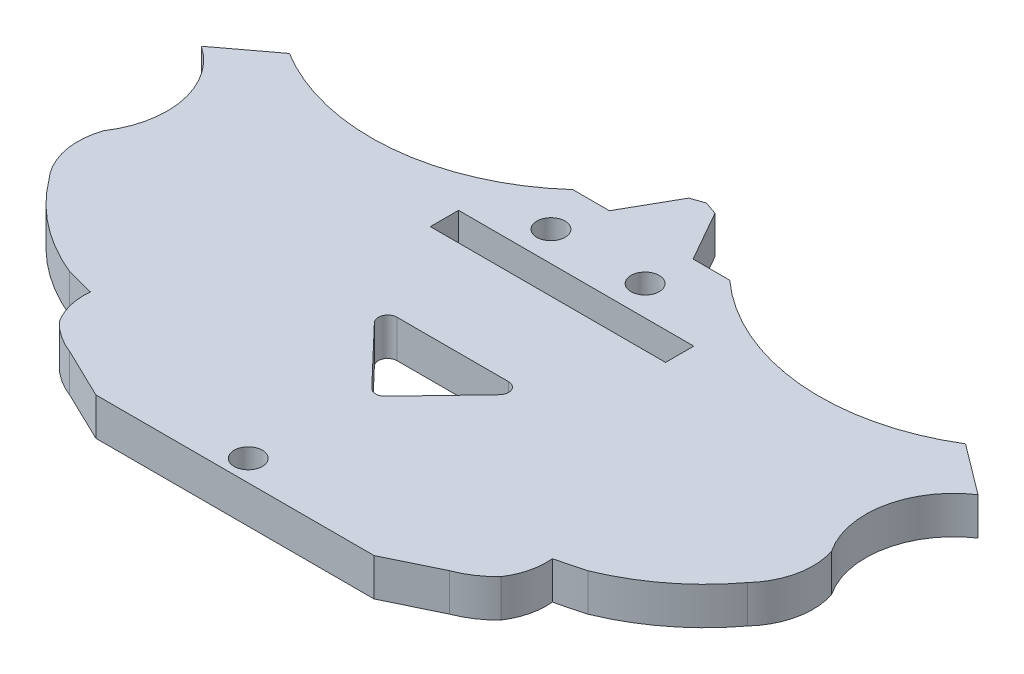
from build123d import *

# Parameters (mm, degrees)
BOSS_EXTRUDE1_DEPTH     = 2
SCALE1_SCALE            = 2
SKETCH6_R               = 1.5
CUT_EXTRUDE2_DEPTH      = 50.464206186
SKETCH7_W               = 25
SKETCH7_H               = 3
BOSS_EXTRUDE2_DEPTH     = 15
SKETCH8_R               = 1.5
SKETCH8_W               = 16
SKETCH8_H               = 11
CUT_EXTRUDE3_DEPTH      = 18
FILLET3_R               = 3
FILLET4_R               = 3
SKETCH10_R              = 1.5
CUT_EXTRUDE4_DEPTH      = 10
CUT_EXTRUDE5_DEPTH      = 52.533558907
CUT_EXTRUDE5_DEPTH_BACK = 52.533558907
SKETCH11_W              = 25
SKETCH11_H              = 3
CUT_EXTRUDE6_DEPTH      = 50.464206186
CUT_EXTRUDE6_DEPTH_BACK = 50.464206186


with BuildPart() as part:
    # Sketch2 → Boss-Extrude1 (new body)
    with BuildSketch(Plane(origin=(0, 0, 0), x_dir=(1, 0, 0), z_dir=(0, 1, 0))):
        with BuildLine():
            Line((-17.967387551, 9.159795774), (-20.639475337, 7.15016677))
            ThreePointArc((-20.639475337, 7.15016677), (-18.649238809, 4.17439457), (-19.346117765, 0.662896123))
            ThreePointArc((-19.346117765, 0.662896123), (-19.45411943, -1.286546543), (-18.558961711, -3.021678736))
            ThreePointArc((-18.558961711, -3.021678736), (-16.421478173, -5.190969631), (-13.78312899, -6.712078584))
            ThreePointArc((-13.78312899, -6.712078584), (-13.032173848, -6.916004841), (-12.276686285, -7.102440046))
            ThreePointArc((-12.276686285, -7.102440046), (-12.194265553, -8.245293076), (-11.737308023, -9.296052821))
            ThreePointArc((-11.737308023, -9.296052821), (-10.975506649, -9.937799505), (-10.090124565, -10.394175126))
            Line((-10.090124565, -10.394175126), (-7.391598262, -11.698651137))
            Line((-7.391598262, -11.698651137), (7.391598262, -11.698651137))
            Line((7.391598262, -11.698651137), (10.090124565, -10.394175126))
            ThreePointArc((10.090124565, -10.394175126), (10.975506649, -9.937799505), (11.737308023, -9.296052821))
            ThreePointArc((11.737308023, -9.296052821), (12.194265553, -8.245293076), (12.276686285, -7.102440046))
            ThreePointArc((12.276686285, -7.102440046), (13.032173848, -6.916004841), (13.78312899, -6.712078584))
            ThreePointArc((13.78312899, -6.712078584), (16.421478173, -5.190969631), (18.558961711, -3.021678736))
            ThreePointArc((18.558961711, -3.021678736), (19.45411943, -1.286546543), (19.346117765, 0.662896123))
            ThreePointArc((19.346117765, 0.662896123), (18.649238809, 4.17439457), (20.639475337, 7.15016677))
            Line((20.639475337, 7.15016677), (17.967387551, 9.159795774))
            ThreePointArc((17.967387551, 9.159795774), (10.858325227, 7.499674132), (4.169484372, 10.424426945))
            Line((4.169484372, 10.424426945), (2.224138848, 10.424426945))
            Line((2.224138848, 10.424426945), (0.696104526, 13.114793475))
            Line((0.696104526, 13.114793475), (0, 13.358013588))
            Line((0, 13.358013588), (-0.696104526, 13.114793475))
            Line((-0.696104526, 13.114793475), (-2.224138848, 10.424426945))
            Line((-2.224138848, 10.424426945), (-4.169484372, 10.424426945))
            ThreePointArc((-4.169484372, 10.424426945), (-10.858325227, 7.499674132), (-17.967387551, 9.159795774))
        make_face()
    extrude(amount=BOSS_EXTRUDE1_DEPTH)


with BuildPart() as part_1:
    # Scale1: scaled about (0, 1, 0.242383844)
    add(part.part.scale(SCALE1_SCALE).moved(Location((0, -1, -0.242383844))))

    # Sketch6 → Cut-Extrude2 (cut, through all)
    with BuildSketch(Plane(origin=(0, 3, 0), x_dir=(1, 0, 0), z_dir=(0, 1, 0))):
        with Locations(Location((-5.851533015, 16.28357055, 0), (0, 0, 270))):
            Circle(SKETCH6_R)
        with Locations(Location((4.151829214, 16.28357055, 0), (0, 0, 270))):
            Circle(SKETCH6_R)
    extrude(amount=-CUT_EXTRUDE2_DEPTH, mode=Mode.SUBTRACT)

    # Sketch7 → Boss-Extrude2 (add)
    with BuildSketch(Plane(origin=(0, 3, 0), x_dir=(1, 0, 0), z_dir=(0, 1, 0))):
        with Locations((0, 11.610861671)):
            Rectangle(SKETCH7_W, SKETCH7_H)
    extrude(amount=BOSS_EXTRUDE2_DEPTH)

    # Sketch8 → Cut-Extrude3 (cut)
    with BuildSketch(Plane.XY.offset(-10.110861671)):
        with Locations((-9.75, 10.917386914)):
            Circle(SKETCH8_R)
        with Locations((9.75, 10.917386914)):
            Circle(SKETCH8_R)
        with Locations((0, 10.917386914)):
            Rectangle(SKETCH8_W, SKETCH8_H)
    extrude(amount=-CUT_EXTRUDE3_DEPTH, mode=Mode.SUBTRACT)

    # Fillet3
    fillet3_edges = [part_1.edges().sort_by_distance(p)[0] for p in [
        (-12.5, 18, -11.610861671),
    ]]
    fillet(fillet3_edges, radius=FILLET3_R)

    # Fillet4
    fillet4_edges = [part_1.edges().sort_by_distance(p)[0] for p in [
        (12.5, 18, -11.610861671),
    ]]
    fillet(fillet4_edges, radius=FILLET4_R)

    # Sketch10 → Cut-Extrude4 (cut)
    with BuildSketch(Plane(origin=(0, 3, 0), x_dir=(1, 0, 0), z_dir=(0, 1, 0))):
        with Locations(Location((-0.8498519, -20.895328087, 0), (0, 0, 270))):
            Circle(SKETCH10_R)
    extrude(amount=-CUT_EXTRUDE4_DEPTH, mode=Mode.SUBTRACT)

    # Sketch11 → Cut-Extrude5 (cut, two sides: drawn at the far end of the back side and taken through both)
    with BuildSketch(Plane(origin=(0, 3, 0), x_dir=(1, 0, 0), z_dir=(0, 1, 0)).offset(-CUT_EXTRUDE5_DEPTH_BACK)):
        with Locations((0, 11.610861671)):
            Rectangle(SKETCH11_W, SKETCH11_H)
    extrude(amount=CUT_EXTRUDE5_DEPTH + CUT_EXTRUDE5_DEPTH_BACK, mode=Mode.SUBTRACT)

    # Sketch12 → Cut-Extrude6 (cut, two sides: drawn at the far end of the back side and taken through both)
    with BuildSketch(Plane(origin=(0, 3, 0), x_dir=(1, 0, 0), z_dir=(0, 1, 0)).offset(-CUT_EXTRUDE6_DEPTH_BACK)):
        with BuildLine():
            Line((-5.923543235, 0), (5.923543235, 0))
            ThreePointArc((5.923543235, 0), (6.842985975, -0.606776086), (6.646636982, -1.690749907))
            Line((6.646636982, -1.690749907), (0.723093747, -7.891658559))
            ThreePointArc((0.723093747, -7.891658559), (0, -8.200908652), (-0.723093747, -7.891658559))
            Line((-0.723093747, -7.891658559), (-6.646636982, -1.690749907))
            ThreePointArc((-6.646636982, -1.690749907), (-6.842985975, -0.606776086), (-5.923543235, 0))
        make_face()
    extrude(amount=CUT_EXTRUDE6_DEPTH + CUT_EXTRUDE6_DEPTH_BACK, mode=Mode.SUBTRACT)


solid = part_1.part
